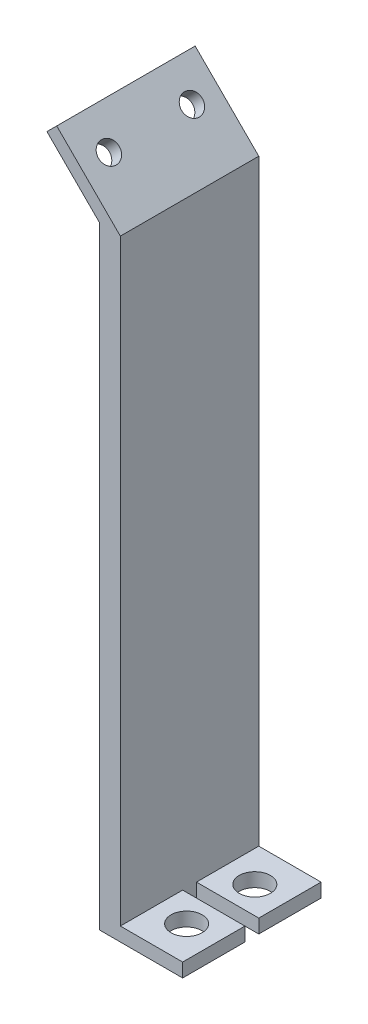
from build123d import *

# Parameters (mm, degrees)
EXTRUDE_1_DEPTH             = 20
SKETCH_2_W                  = 9
SKETCH_2_H                  = 2
EXTRUDE_2_DEPTH             = 9
SKETCH_3_W                  = 9
SKETCH_3_H                  = 2
EXTRUDE_3_DEPTH             = 9
HOLE_WIZARD_3_0_3_1_D       = 3
HOLE_WIZARD_3_0_3_1_DEPTH   = 14.863961031
HOLE_WIZARD_4_5_4_5_1_D     = 4.5
HOLE_WIZARD_4_5_4_5_1_DEPTH = 97.52081528


with BuildPart() as part:
    # 草图1 → 凸台-拉伸1 (new body)
    with BuildSketch(Plane.XY.offset(14.375)):
        Polygon((8.875, -83.5), (11.875, -83.5), (11.875, 4.828427125), (2.682611845, 14.02081528), (1.268398282, 12.606601718), (8.875, 5), align=None)
    extrude(amount=-EXTRUDE_1_DEPTH)

    # 草图2 → 凸台-拉伸2 (add)
    with BuildSketch(Plane(origin=(11.875, 0, 0), x_dir=(0, 0, -1), z_dir=(1, 0, 0))):
        with Locations((-9.875, -82.5)):
            Rectangle(SKETCH_2_W, SKETCH_2_H)
    extrude(amount=EXTRUDE_2_DEPTH)

    # 草图3 → 凸台-拉伸3 (add)
    with BuildSketch(Plane(origin=(11.875, 0, 0), x_dir=(0, 0, -1), z_dir=(1, 0, 0))):
        with Locations((1.125, -82.5)):
            Rectangle(SKETCH_3_W, SKETCH_3_H)
    extrude(amount=EXTRUDE_3_DEPTH)

    # Ø3.0 (3) 直径孔1
    with Locations(Plane(origin=(6.9375, 6.9375, 0), x_dir=(0, 0, 1), z_dir=(-0.7071067811865481, -0.707106781186547, 0))):
        with Locations((10.375, 3.017320536), (-1.625, 3.017320536)):
            Hole(HOLE_WIZARD_3_0_3_1_D / 2, depth=HOLE_WIZARD_3_0_3_1_DEPTH)

    # Ø4.5 (4.5) 直径孔1
    with Locations(Plane(origin=(0, -83.5, 0), x_dir=(-1, 0, 0), z_dir=(0, -1, 0))):
        with Locations((-16.375, -9.3), (-16.375, 0.55)):
            Hole(HOLE_WIZARD_4_5_4_5_1_D / 2, depth=HOLE_WIZARD_4_5_4_5_1_DEPTH)


solid = part.part
